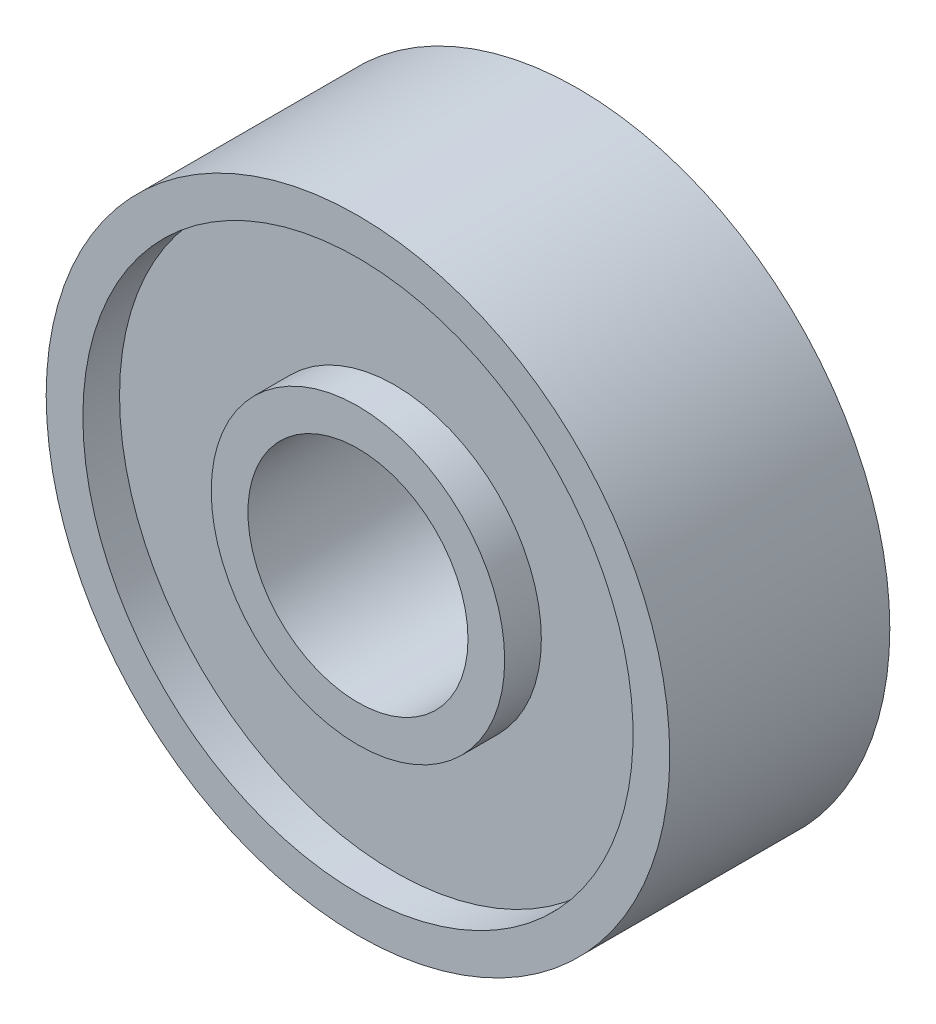
from build123d import *

# Parameters (mm, degrees)
SKETCH1_R           = 8.5
SKETCH1_R_2         = 3
BOSS_EXTRUDE1_DEPTH = 6
SKETCH2_W           = 3.5
SKETCH2_H           = 1
SKETCH3_W           = 3.5
SKETCH3_H           = 1


with BuildPart() as part:
    # Sketch1 → Boss-Extrude1 (new body)
    with BuildSketch(Plane.XY):
        Circle(SKETCH1_R)
        Circle(SKETCH1_R_2, mode=Mode.SUBTRACT)
    extrude(amount=BOSS_EXTRUDE1_DEPTH)

    # Sketch2 → Cut-Revolve1 (revolve, cut)
    with BuildSketch(Plane(origin=(0, 0, 0), x_dir=(1, 0, 0), z_dir=(0, 1, 0)), mode=Mode.PRIVATE) as cut_revolve1_sk:
        with Locations((5.75, -0.5)):
            Rectangle(SKETCH2_W, SKETCH2_H)
    revolve(cut_revolve1_sk.sketch.rotate(Axis((0, 0, 0), (0, 0, 1)), 180), axis=Axis((0, 0, 0), (0, 0, 1)), mode=Mode.SUBTRACT)

    # Sketch3 → Cut-Revolve2 (revolve, cut)
    with BuildSketch(Plane(origin=(0, 0, 0), x_dir=(1, 0, 0), z_dir=(0, 1, 0)), mode=Mode.PRIVATE) as cut_revolve2_sk:
        with Locations((5.75, -5.5)):
            Rectangle(SKETCH3_W, SKETCH3_H)
    revolve(cut_revolve2_sk.sketch.rotate(Axis((0, 0, 0), (0, 0, 1)), 180), axis=Axis((0, 0, 0), (0, 0, 1)), mode=Mode.SUBTRACT)


solid = part.part
